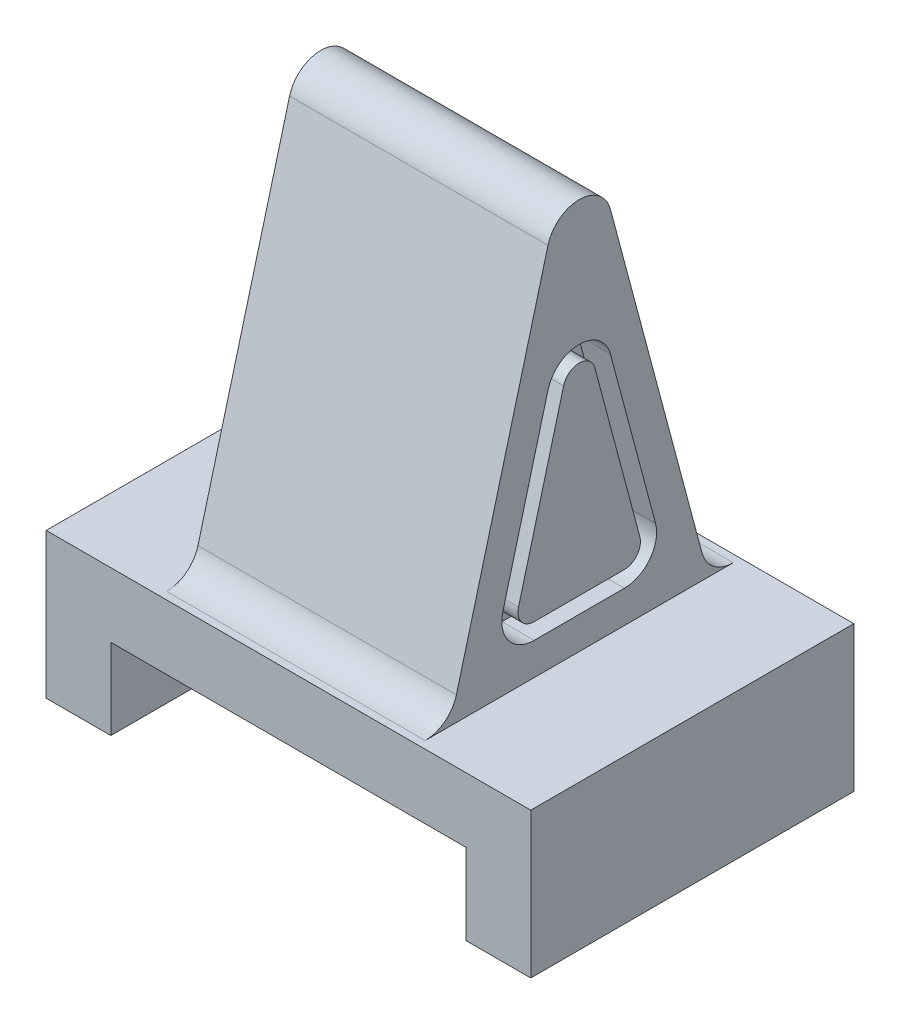
from build123d import *

# Parameters (mm, degrees)
EXTRUDE_1_DEPTH      = 10
EXTRUDE_3_DEPTH      = 4
EXTRUDE_3_DEPTH_BACK = 4
FILLET_3_R           = 1
CUT_EXTRUDE_2_DEPTH  = 1


with BuildPart() as part:
    # 草图1 → 凸台-拉伸1 (new body)
    with BuildSketch(Plane.XY):
        Polygon((0, 0), (0, 2.5), (11, 2.5), (11, 0), (13, 0), (13, 4.5), (-2, 4.5), (-2, 0), align=None)
    extrude(amount=EXTRUDE_1_DEPTH)

    # 草图7 → 凸台-拉伸3 (add, two sides: drawn at the far end of the back side and taken through both)
    with BuildSketch(Plane(origin=(5.5, 0, 0), x_dir=(0, 0, -1), z_dir=(1, 0, 0)).offset(-EXTRUDE_3_DEPTH_BACK)):
        Polygon((-9, 4.5), (-5, 19.5), (-1, 4.5), align=None)
    extrude(amount=EXTRUDE_3_DEPTH + EXTRUDE_3_DEPTH_BACK)

    # 圆角3
    fillet_3_edges = [part.edges().sort_by_distance(p)[0] for p in [
        (5.5, 4.5, 1),
        (5.5, 4.5, 9),
        (5.5, 19.5, 5),
    ]]
    fillet(fillet_3_edges, radius=FILLET_3_R)

    # 草图8 → 切除-拉伸2 (cut)
    with BuildSketch(Plane(origin=(9.5, 0, 0), x_dir=(0, 0, -1), z_dir=(1, 0, 0))):
        with BuildLine():
            Line((-2.636988353, 6.757662651), (-4.03376506, 11.995575302))
            ThreePointArc((-4.03376506, 11.995575302), (-5, 12.737912652), (-5.96623494, 11.995575302))
            Line((-5.96623494, 11.995575302), (-7.363011647, 6.757662651))
            ThreePointArc((-7.363011647, 6.757662651), (-7.189765563, 5.89076386), (-6.396776707, 5.5))
            Line((-6.396776707, 5.5), (-3.603223293, 5.5))
            ThreePointArc((-3.603223293, 5.5), (-2.810234437, 5.89076386), (-2.636988353, 6.757662651))
        make_face()
        with BuildLine():
            ThreePointArc((-6.879894177, 6.628831325), (-6.793271135, 6.19538193), (-6.396776707, 6))
            Line((-6.396776707, 6), (-3.603223293, 6))
            ThreePointArc((-3.603223293, 6), (-3.206728865, 6.19538193), (-3.120105823, 6.628831325))
            Line((-3.120105823, 6.628831325), (-4.51688253, 11.866743977))
            ThreePointArc((-4.51688253, 11.866743977), (-5, 12.237912652), (-5.48311747, 11.866743977))
            Line((-5.48311747, 11.866743977), (-6.879894177, 6.628831325))
        make_face(mode=Mode.SUBTRACT)
    cut_extrude_2 = extrude(amount=-CUT_EXTRUDE_2_DEPTH, mode=Mode.SUBTRACT)

    # 镜向1: 切除-拉伸2 across plane
    add(cut_extrude_2.mirror(Plane(origin=(5.5, 0, 0), x_dir=(0, 0, 1), z_dir=(1, 0, 0))), mode=Mode.SUBTRACT)


solid = part.part
